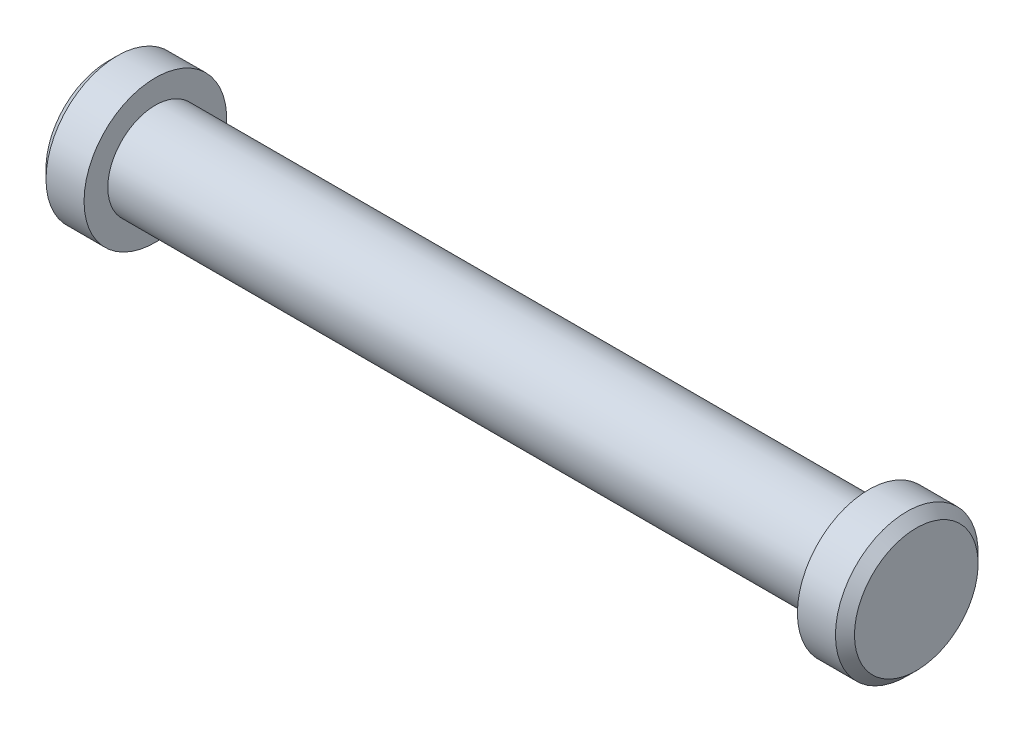
from build123d import *

# Parameters (mm, degrees)
CHAMFER1_SIZE = 0.254
SCALE1_SCALE  = 1.5


with BuildPart() as part:
    # Sketch1 → Revolve1 (revolve)
    with BuildSketch(Plane.XY, mode=Mode.PRIVATE) as revolve1_sk:
        Polygon((-10.795, 0), (-10.795, 1.905), (-9.525, 1.905), (-9.525, 1.27), (9.525, 1.27), (9.525, 1.905), (10.795, 1.905), (10.795, 0), align=None)
    revolve(revolve1_sk.sketch.rotate(Axis((-10.795, 0, 0), (1, 0, 0)), 90), axis=Axis((-10.795, 0, 0), (1, 0, 0)))

    # Chamfer1
    chamfer1_edges = [part.edges().sort_by_distance(p)[0] for p in [
        (10.795, 0, -1.905),
        (-10.795, 0, -1.905),
    ]]
    chamfer(chamfer1_edges, length=CHAMFER1_SIZE)


with BuildPart() as part_1:
    # Scale1: scaled about (0, 0, 0)
    add(part.part.scale(SCALE1_SCALE))


solid = part_1.part
